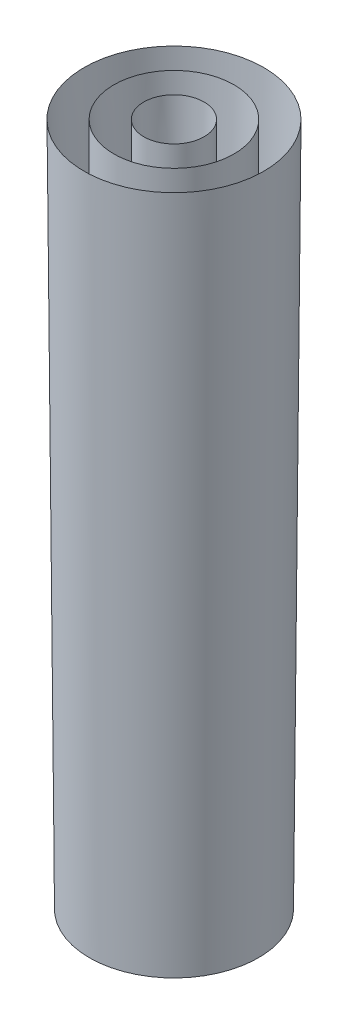
from build123d import *


with BuildPart() as part:
    # Эскиз1 → Повернуть1 (revolve)
    with BuildSketch(Plane.XY, mode=Mode.PRIVATE) as revolve_1_sk:
        Polygon((-2.624106939, 0), (3.925845078, 150), (3.925845078, 0), (10.475797094, 150), (10.475797094, 0), (17.02574911, 150), (15.859832007, 0), (15.311838216, 0), (15.852343113, 110.47254002), (11.684286956, 13.963376462), (10.989801748, -0.846269258), (10.189675666, -0.846269258), (9.467789771, 109.948786309), (4.600142305, 6.147965775), (4.258704841, -1.133064573), (3.526867258, -1.133064573), (3.220264843, 109.948786309), (-1.935686028, 0), align=None)
    revolve(revolve_1_sk.sketch.rotate(Axis((-2.687740891, -0.11397744, 0), (0, 1, 0)), 90), axis=Axis((-2.687740891, -0.11397744, 0), (0, 1, 0)))


solid = part.part
